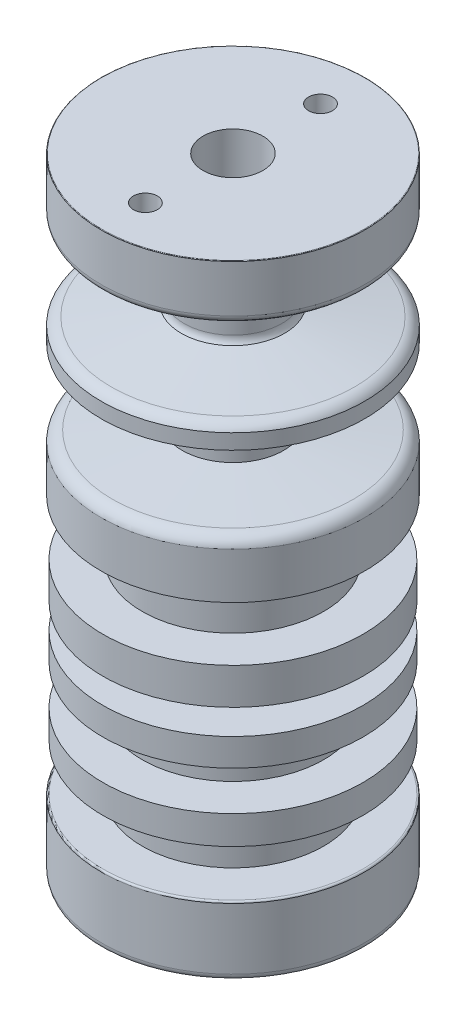
from build123d import *

# Parameters (mm, degrees)
CROQUIS2_R            = 3.175
CORTAR_EXTRUIR2_DEPTH = 12
CROQUIS5_R            = 7.9375
CORTAR_EXTRUIR3_DEPTH = 18
CROQUIS6_R            = 7.9375
CORTAR_EXTRUIR4_DEPTH = 12


with BuildPart() as part:
    # Croquis1 → Revolución3 (revolve)
    with BuildSketch(Plane.XY, mode=Mode.PRIVATE) as revoluci_n3_sk:
        with BuildLine():
            Line((0, 43.044568245), (34.858419682, 43.044568245))
            ThreePointArc((34.858419682, 43.044568245), (34.958532085, 43.00310033), (35, 42.902987927))
            Line((35, 42.902987927), (35, 30.36601493))
            ThreePointArc((35, 30.36601493), (34.403772828, 28.926595206), (32.964353105, 28.330368034))
            Line((32.964353105, 28.330368034), (12.985796912, 28.330368034))
            Line((12.985796912, 28.330368034), (12.985796912, 10.406207601))
            ThreePointArc((12.985796912, 10.406207601), (13.175212613, 9.391052882), (13.717969076, 8.512512712))
            Line((13.717969076, 8.512512712), (32.309744815, 5.485961945))
            ThreePointArc((32.309744815, 5.485961945), (33.884795273, 4.831882369), (35, 3.541563627))
            Line((35, 3.541563627), (35, -0.490098714))
            Line((35, -0.490098714), (13.468735488, -0.490098714))
            Line((13.468735488, -0.490098714), (13.468735488, -18.538757946))
            Line((13.468735488, -18.538757946), (31.979226627, -20.513196287))
            ThreePointArc((31.979226627, -20.513196287), (33.927671218, -21.380602851), (35, -23.224224681))
            Line((35, -23.224224681), (35, -35.501069654))
            Line((35, -35.501069654), (24.086053365, -35.501069654))
            Line((24.086053365, -35.501069654), (24.086053365, -50.263273296))
            Line((24.086053365, -50.263273296), (34.538342083, -50.263273296))
            Line((34.538342083, -50.263273296), (34.538342083, -59.917933312))
            Line((34.538342083, -59.917933312), (24.086053365, -59.917933312))
            Line((24.086053365, -59.917933312), (24.086053365, -66.61708516))
            Line((24.086053365, -66.61708516), (34.538342083, -66.61708516))
            Line((34.538342083, -66.61708516), (34.538342083, -73.907338641))
            Line((34.538342083, -73.907338641), (24.086053365, -73.907338641))
            Line((24.086053365, -73.907338641), (24.086053365, -84.350134169))
            Line((24.086053365, -84.350134169), (34.538342083, -84.350134169))
            Line((34.538342083, -84.350134169), (34.538342083, -91.92338166))
            Line((34.538342083, -91.92338166), (24.086053365, -91.92338166))
            Line((24.086053365, -91.92338166), (24.086053365, -104.221668074))
            Line((24.086053365, -104.221668074), (34.538342083, -104.221668074))
            ThreePointArc((34.538342083, -104.221668074), (34.864783527, -104.356884547), (35, -104.683325991))
            Line((35, -104.683325991), (35, -120.950877143))
            ThreePointArc((35, -120.950877143), (34.933442046, -121.487214162), (34.737806004, -121.991013624))
            Line((34.737806004, -121.991013624), (0, -121.955431755))
            Line((0, -121.955431755), (0, 43.044568245))
        make_face()
    revolve(revoluci_n3_sk.sketch.rotate(Axis((0, 43.044568245, 0), (0, -1, 0)), 180), axis=Axis((0, 43.044568245, 0), (0, -1, 0)))

    # Croquis2 → Cortar-Extruir2 (cut)
    with BuildSketch(Plane(origin=(0, 43.044568245, 0), x_dir=(1, 0, 0), z_dir=(0, 1, 0))):
        with Locations(Location((-0.244873022, -23, 0), (0, 0, 270))):
            Circle(CROQUIS2_R)
        with Locations(Location((0.244873022, 23, 0), (0, 0, 270))):
            Circle(CROQUIS2_R)
    extrude(amount=-CORTAR_EXTRUIR2_DEPTH, mode=Mode.SUBTRACT)

    # Croquis5 → Cortar-Extruir3 (cut)
    with BuildSketch(Plane(origin=(0, -104.221668074, 0), x_dir=(1, 0, 0), z_dir=(0, 1, 0))):
        with Locations(Location((0.097949209, 0, 0), (0, 0, 270))):
            Circle(CROQUIS5_R)
    extrude(amount=-CORTAR_EXTRUIR3_DEPTH, mode=Mode.SUBTRACT)

    # Croquis6 → Cortar-Extruir4 (cut)
    with BuildSketch(Plane(origin=(0, 43.044568245, 0), x_dir=(1, 0, 0), z_dir=(0, 1, 0))):
        with Locations(Location((0, 0, 0), (0, 0, 270))):
            Circle(CROQUIS6_R)
    extrude(amount=-CORTAR_EXTRUIR4_DEPTH, mode=Mode.SUBTRACT)


solid = part.part
